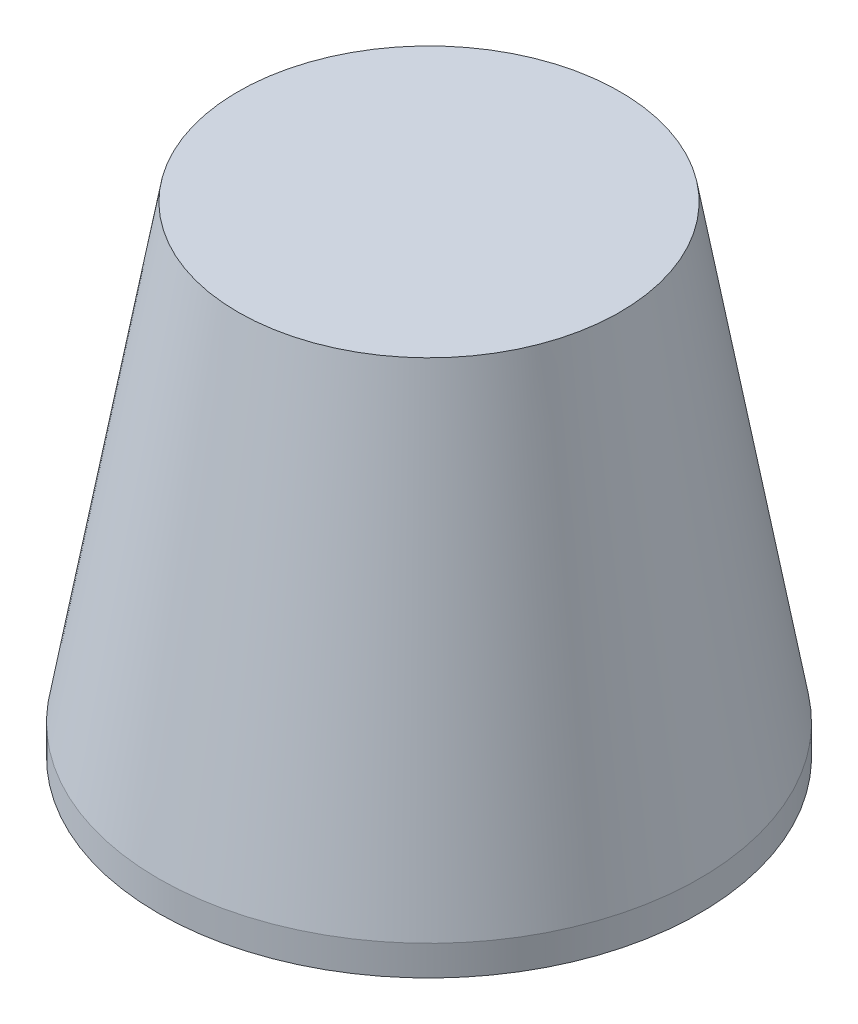
from build123d import *

# Parameters (mm, degrees)
EXTRUDE_1_DEPTH      = 10
EXTRUDE_1_DEPTH_BACK = 6
SKETCH_1_R           = 9
CHAMFER_1_SIZE       = 15
CHAMFER_1_SIZE2      = 2.644904711


with BuildPart() as part:
    # 草图1 → 凸台-拉伸1 (new, two sides: drawn at the far end of the back side and taken through both)
    with BuildSketch(Plane(origin=(0, 0, 0), x_dir=(1, 0, 0), z_dir=(0, 1, 0)).offset(-EXTRUDE_1_DEPTH_BACK)):
        with Locations(Location((0, 0, 0), (0, 0, 270))):
            Circle(SKETCH_1_R)
    extrude(amount=EXTRUDE_1_DEPTH + EXTRUDE_1_DEPTH_BACK)

    # 倒角1
    chamfer_1_edges = [part.edges().sort_by_distance(p)[0] for p in [
        (0, 10, -9),
    ]]
    chamfer_1_side = [part.faces().sort_by_distance(p)[0] for p in [
        (0, 5, -9),
    ]]
    chamfer(chamfer_1_edges, length=CHAMFER_1_SIZE, length2=CHAMFER_1_SIZE2, reference=chamfer_1_side[0])


solid = part.part
